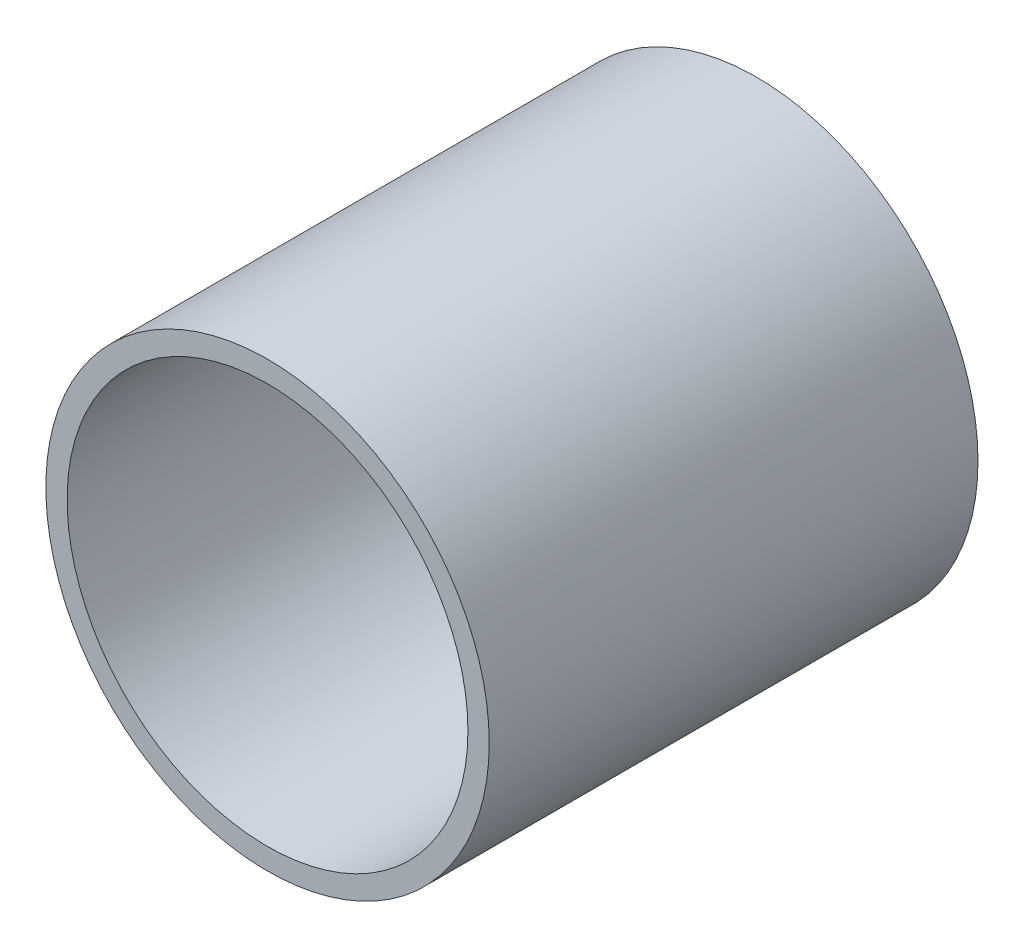
from build123d import *

# Parameters (mm, degrees)
SKETCH1_R           = 31.75
SKETCH1_R_2         = 28.7
BOSS_EXTRUDE1_DEPTH = 70


with BuildPart() as part:
    # Sketch1 → Boss-Extrude1 (new body)
    with BuildSketch(Plane.XY):
        Circle(SKETCH1_R)
        Circle(SKETCH1_R_2, mode=Mode.SUBTRACT)
    extrude(amount=BOSS_EXTRUDE1_DEPTH)


solid = part.part
